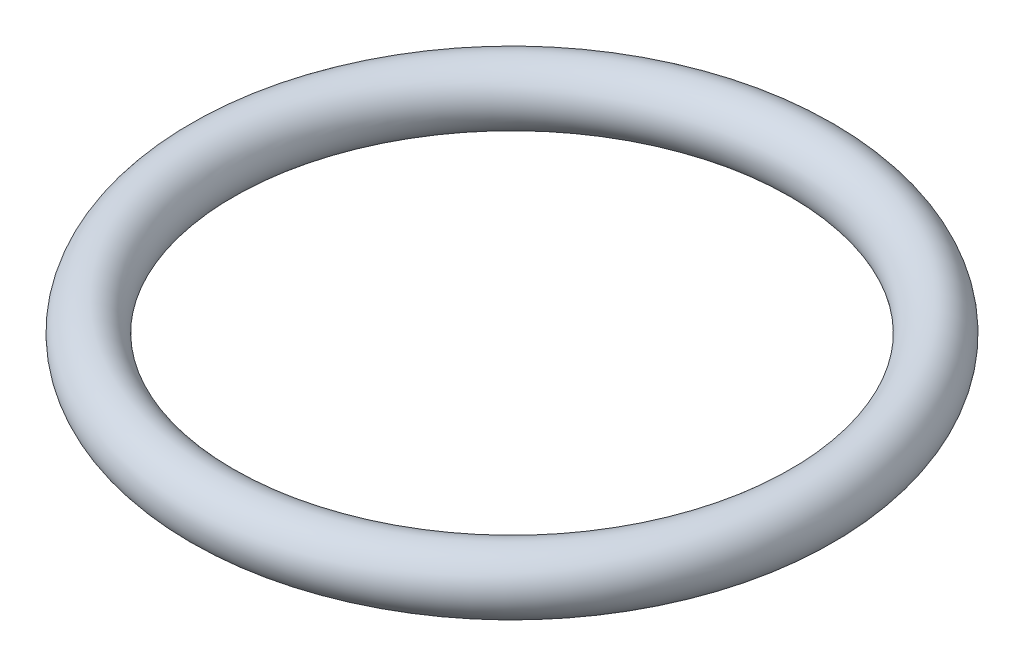
from build123d import *

# Parameters (mm, degrees)
SKETCH1_R = 0.5


with BuildPart() as part:
    # Sketch1 → Revolve1 (revolve)
    with BuildSketch(Plane.XY):
        with Locations((5, 0)):
            Circle(SKETCH1_R)
    revolve(axis=Axis((0, 37.18872447, 0), (0, -1, 0)))


solid = part.part
